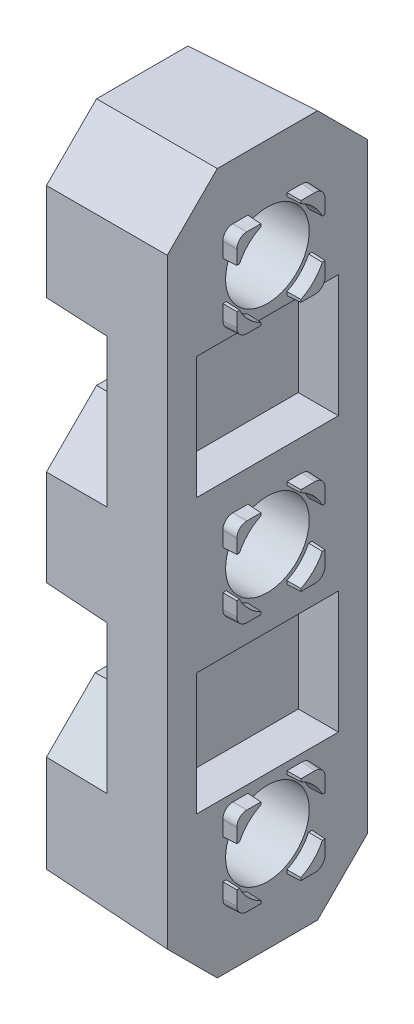
from build123d import *

# Parameters (mm, degrees)
SKETCH1_W            = 9.716506228
SKETCH1_H            = 35.116506228
BOSS_EXTRUDE1_DEPTH  = 6.35
CUT_EXTRUDE1_DEPTH   = 3.175
CUT_EXTRUDE2_DEPTH   = 3.175
CUT_EXTRUDE3_DEPTH   = 3.175
CUT_EXTRUDE4_DEPTH   = 3.175
BOSS_EXTRUDE2_DEPTH  = 0.6858
BOSS_EXTRUDE2_TAPER  = 2
BOSS_EXTRUDE3_DEPTH  = 0.6858
BOSS_EXTRUDE3_TAPER  = 2
BOSS_EXTRUDE4_DEPTH  = 0.6858
BOSS_EXTRUDE4_TAPER  = 2
BOSS_EXTRUDE5_DEPTH  = 0.6858
BOSS_EXTRUDE5_TAPER  = 2
BOSS_EXTRUDE6_DEPTH  = 0.6858
BOSS_EXTRUDE6_TAPER  = 2
BOSS_EXTRUDE7_DEPTH  = 0.6858
BOSS_EXTRUDE7_TAPER  = 2
BOSS_EXTRUDE8_DEPTH  = 0.6858
BOSS_EXTRUDE8_TAPER  = 2
BOSS_EXTRUDE9_DEPTH  = 0.6858
BOSS_EXTRUDE9_TAPER  = 2
BOSS_EXTRUDE10_DEPTH = 0.6858
BOSS_EXTRUDE10_TAPER = 2
BOSS_EXTRUDE11_DEPTH = 0.6858
BOSS_EXTRUDE11_TAPER = 2
BOSS_EXTRUDE12_DEPTH = 0.6858
BOSS_EXTRUDE12_TAPER = 2
BOSS_EXTRUDE13_DEPTH = 0.6858
BOSS_EXTRUDE13_TAPER = 2
SKETCH18_W           = 7.200000746
SKETCH18_H           = 6.200001039
CUT_EXTRUDE5_DEPTH   = 2.032
SKETCH19_W           = 7.200000746
SKETCH19_H           = 6.200000866
CUT_EXTRUDE6_DEPTH   = 2.032
DRAFT1_ANGLE         = 2.827279459
DRAFT2_ANGLE         = 2
HOLE1_D              = 4.2418
HOLE1_DEPTH          = 7.0358
CHAMFER1_SIZE        = 2.536908263
CHAMFER1_EDGE_2_SIZE = 2.536908263
CHAMFER1_EDGE_3_SIZE = 2.536908263
CHAMFER1_EDGE_4_SIZE = 2.536908263
FILLET1_R            = 0.507999989


with BuildPart() as part:
    # Sketch1 → Boss-Extrude1 (new body)
    with BuildSketch(Plane(origin=(88.976200533, 0, 0), x_dir=(0, 0, -1), z_dir=(1, 0, 0))):
        with Locations((12.699999697, 26.416015382)):
            Rectangle(SKETCH1_W, SKETCH1_H)
    extrude(amount=-BOSS_EXTRUDE1_DEPTH)

    # Sketch2 → Cut-Extrude1 (cut)
    with BuildSketch(Plane.ZY.offset(-82.626200533)):
        Polygon((-7.841746583, 36.509270747), (-10.315251163, 34.035766168), (-11.699992639, 34.035766168), (-11.699992639, 31.385266496), (-10.380199322, 31.385266496), (-7.841746583, 28.846813757), align=None)
    extrude(amount=-CUT_EXTRUDE1_DEPTH, mode=Mode.SUBTRACT)

    # Sketch3 → Cut-Extrude2 (cut)
    with BuildSketch(Plane.ZY.offset(-82.626200533)):
        Polygon((-7.841746583, 23.985217007), (-10.380199322, 21.446764268), (-11.699997599, 21.446764268), (-11.699997599, 18.796264596), (-10.315251163, 18.796264596), (-7.841746583, 16.322760016), align=None)
    extrude(amount=-CUT_EXTRUDE2_DEPTH, mode=Mode.SUBTRACT)

    # Sketch4 → Cut-Extrude3 (cut)
    with BuildSketch(Plane.ZY.offset(-82.626200533)):
        Polygon((-17.558252811, 16.322760016), (-15.084748232, 18.796264596), (-13.699997366, 18.796264596), (-13.699997366, 21.446764268), (-15.019800072, 21.446764268), (-17.558252811, 23.985217007), align=None)
    extrude(amount=-CUT_EXTRUDE3_DEPTH, mode=Mode.SUBTRACT)

    # Sketch5 → Cut-Extrude4 (cut)
    with BuildSketch(Plane.ZY.offset(-82.626200533)):
        Polygon((-17.558252811, 28.846813757), (-15.019800072, 31.385266496), (-13.699992522, 31.385266496), (-13.699992522, 34.035766168), (-15.084748232, 34.035766168), (-17.558252811, 36.509270747), align=None)
    extrude(amount=-CUT_EXTRUDE4_DEPTH, mode=Mode.SUBTRACT)

    # Sketch6 → Boss-Extrude2 (add)
    with BuildSketch(Plane(origin=(88.976200533, 0, 0), x_dir=(0, 0, -1), z_dir=(1, 0, 0))):
        with BuildLine():
            ThreePointArc((11.709394811, 24.327642329), (11.065588197, 24.781603881), (10.611626644, 25.425410496))
            Line((10.611626644, 25.425410496), (10.439394811, 25.425410496))
            Line((10.439394811, 25.425410496), (10.439394811, 24.155410496))
            Line((10.439394811, 24.155410496), (11.709394811, 24.155410496))
            Line((11.709394811, 24.155410496), (11.709394811, 24.327642329))
        make_face()
    extrude(amount=BOSS_EXTRUDE2_DEPTH, taper=BOSS_EXTRUDE2_TAPER)

    # Sketch7 → Boss-Extrude3 (add)
    with BuildSketch(Plane(origin=(88.976200533, 0, 0), x_dir=(0, 0, -1), z_dir=(1, 0, 0))):
        with BuildLine():
            ThreePointArc((14.788362978, 25.425410496), (14.334401425, 24.781603881), (13.690594811, 24.327642329))
            Line((13.690594811, 24.327642329), (13.690594811, 24.155410496))
            Line((13.690594811, 24.155410496), (14.960594811, 24.155410496))
            Line((14.960594811, 24.155410496), (14.960594811, 25.425410496))
            Line((14.960594811, 25.425410496), (14.788362978, 25.425410496))
        make_face()
    extrude(amount=BOSS_EXTRUDE3_DEPTH, taper=BOSS_EXTRUDE3_TAPER)

    # Sketch8 → Boss-Extrude4 (add)
    with BuildSketch(Plane(origin=(88.976200533, 0, 0), x_dir=(0, 0, -1), z_dir=(1, 0, 0))):
        with BuildLine():
            ThreePointArc((13.690594811, 28.504378662), (14.334401425, 28.05041711), (14.788362978, 27.406610496))
            Line((14.788362978, 27.406610496), (14.960594811, 27.406610496))
            Line((14.960594811, 27.406610496), (14.960594811, 28.676610496))
            Line((14.960594811, 28.676610496), (13.690594811, 28.676610496))
            Line((13.690594811, 28.676610496), (13.690594811, 28.504378662))
        make_face()
    extrude(amount=BOSS_EXTRUDE4_DEPTH, taper=BOSS_EXTRUDE4_TAPER)

    # Sketch9 → Boss-Extrude5 (add)
    with BuildSketch(Plane(origin=(88.976200533, 0, 0), x_dir=(0, 0, -1), z_dir=(1, 0, 0))):
        with BuildLine():
            ThreePointArc((10.611626644, 27.406610496), (11.065588197, 28.05041711), (11.709394811, 28.504378662))
            Line((11.709394811, 28.504378662), (11.709394811, 28.676610496))
            Line((11.709394811, 28.676610496), (10.439394811, 28.676610496))
            Line((10.439394811, 28.676610496), (10.439394811, 27.406610496))
            Line((10.439394811, 27.406610496), (10.611626644, 27.406610496))
        make_face()
    extrude(amount=BOSS_EXTRUDE5_DEPTH, taper=BOSS_EXTRUDE5_TAPER)

    # Sketch10 → Boss-Extrude6 (add)
    with BuildSketch(Plane(origin=(88.976200533, 0, 0), x_dir=(0, 0, -1), z_dir=(1, 0, 0))):
        with BuildLine():
            ThreePointArc((11.709394811, 37.027642329), (11.065588197, 37.481603881), (10.611626644, 38.125410496))
            Line((10.611626644, 38.125410496), (10.439394811, 38.125410496))
            Line((10.439394811, 38.125410496), (10.439394811, 36.855410496))
            Line((10.439394811, 36.855410496), (11.709394811, 36.855410496))
            Line((11.709394811, 36.855410496), (11.709394811, 37.027642329))
        make_face()
    extrude(amount=BOSS_EXTRUDE6_DEPTH, taper=BOSS_EXTRUDE6_TAPER)

    # Sketch11 → Boss-Extrude7 (add)
    with BuildSketch(Plane(origin=(88.976200533, 0, 0), x_dir=(0, 0, -1), z_dir=(1, 0, 0))):
        with BuildLine():
            ThreePointArc((14.788362978, 38.125410496), (14.334401425, 37.481603881), (13.690594811, 37.027642329))
            Line((13.690594811, 37.027642329), (13.690594811, 36.855410496))
            Line((13.690594811, 36.855410496), (14.960594811, 36.855410496))
            Line((14.960594811, 36.855410496), (14.960594811, 38.125410496))
            Line((14.960594811, 38.125410496), (14.788362978, 38.125410496))
        make_face()
    extrude(amount=BOSS_EXTRUDE7_DEPTH, taper=BOSS_EXTRUDE7_TAPER)

    # Sketch12 → Boss-Extrude8 (add)
    with BuildSketch(Plane(origin=(88.976200533, 0, 0), x_dir=(0, 0, -1), z_dir=(1, 0, 0))):
        with BuildLine():
            ThreePointArc((13.690594811, 41.204378662), (14.334401425, 40.75041711), (14.788362978, 40.106610496))
            Line((14.788362978, 40.106610496), (14.960594811, 40.106610496))
            Line((14.960594811, 40.106610496), (14.960594811, 41.376610496))
            Line((14.960594811, 41.376610496), (13.690594811, 41.376610496))
            Line((13.690594811, 41.376610496), (13.690594811, 41.204378662))
        make_face()
    extrude(amount=BOSS_EXTRUDE8_DEPTH, taper=BOSS_EXTRUDE8_TAPER)

    # Sketch13 → Boss-Extrude9 (add)
    with BuildSketch(Plane(origin=(88.976200533, 0, 0), x_dir=(0, 0, -1), z_dir=(1, 0, 0))):
        with BuildLine():
            ThreePointArc((10.611626644, 40.106610496), (11.065588197, 40.75041711), (11.709394811, 41.204378662))
            Line((11.709394811, 41.204378662), (11.709394811, 41.376610496))
            Line((11.709394811, 41.376610496), (10.439394811, 41.376610496))
            Line((10.439394811, 41.376610496), (10.439394811, 40.106610496))
            Line((10.439394811, 40.106610496), (10.611626644, 40.106610496))
        make_face()
    extrude(amount=BOSS_EXTRUDE9_DEPTH, taper=BOSS_EXTRUDE9_TAPER)

    # Sketch14 → Boss-Extrude10 (add)
    with BuildSketch(Plane(origin=(88.976200533, 0, 0), x_dir=(0, 0, -1), z_dir=(1, 0, 0))):
        with BuildLine():
            ThreePointArc((11.709394811, 11.627642329), (11.065588197, 12.081603882), (10.611626644, 12.725410496))
            Line((10.611626644, 12.725410496), (10.439394811, 12.725410496))
            Line((10.439394811, 12.725410496), (10.439394811, 11.455410496))
            Line((10.439394811, 11.455410496), (11.709394811, 11.455410496))
            Line((11.709394811, 11.455410496), (11.709394811, 11.627642329))
        make_face()
    extrude(amount=BOSS_EXTRUDE10_DEPTH, taper=BOSS_EXTRUDE10_TAPER)

    # Sketch15 → Boss-Extrude11 (add)
    with BuildSketch(Plane(origin=(88.976200533, 0, 0), x_dir=(0, 0, -1), z_dir=(1, 0, 0))):
        with BuildLine():
            ThreePointArc((14.788362978, 12.725410496), (14.334401425, 12.081603882), (13.690594811, 11.627642329))
            Line((13.690594811, 11.627642329), (13.690594811, 11.455410496))
            Line((13.690594811, 11.455410496), (14.960594811, 11.455410496))
            Line((14.960594811, 11.455410496), (14.960594811, 12.725410496))
            Line((14.960594811, 12.725410496), (14.788362978, 12.725410496))
        make_face()
    extrude(amount=BOSS_EXTRUDE11_DEPTH, taper=BOSS_EXTRUDE11_TAPER)

    # Sketch16 → Boss-Extrude12 (add)
    with BuildSketch(Plane(origin=(88.976200533, 0, 0), x_dir=(0, 0, -1), z_dir=(1, 0, 0))):
        with BuildLine():
            ThreePointArc((13.690594811, 15.804378662), (14.334401425, 15.35041711), (14.788362978, 14.706610496))
            Line((14.788362978, 14.706610496), (14.960594811, 14.706610496))
            Line((14.960594811, 14.706610496), (14.960594811, 15.976610496))
            Line((14.960594811, 15.976610496), (13.690594811, 15.976610496))
            Line((13.690594811, 15.976610496), (13.690594811, 15.804378662))
        make_face()
    extrude(amount=BOSS_EXTRUDE12_DEPTH, taper=BOSS_EXTRUDE12_TAPER)

    # Sketch17 → Boss-Extrude13 (add)
    with BuildSketch(Plane(origin=(88.976200533, 0, 0), x_dir=(0, 0, -1), z_dir=(1, 0, 0))):
        with BuildLine():
            ThreePointArc((10.611626644, 14.706610496), (11.065588197, 15.35041711), (11.709394811, 15.804378662))
            Line((11.709394811, 15.804378662), (11.709394811, 15.976610496))
            Line((11.709394811, 15.976610496), (10.439394811, 15.976610496))
            Line((10.439394811, 15.976610496), (10.439394811, 14.706610496))
            Line((10.439394811, 14.706610496), (10.611626644, 14.706610496))
        make_face()
    extrude(amount=BOSS_EXTRUDE13_DEPTH, taper=BOSS_EXTRUDE13_TAPER)

    # Sketch18 → Cut-Extrude5 (cut)
    with BuildSketch(Plane(origin=(88.976200533, 0, 0), x_dir=(0, 0, -1), z_dir=(1, 0, 0))):
        with Locations((12.699998305, 19.46600963)):
            Rectangle(SKETCH18_W, SKETCH18_H)
    extrude(amount=-CUT_EXTRUDE5_DEPTH, mode=Mode.SUBTRACT)

    # Sketch19 → Cut-Extrude6 (cut)
    with BuildSketch(Plane(origin=(88.976200533, 0, 0), x_dir=(0, 0, -1), z_dir=(1, 0, 0))):
        with Locations((12.699992957, 33.366009543)):
            Rectangle(SKETCH19_W, SKETCH19_H)
    extrude(amount=-CUT_EXTRUDE6_DEPTH, mode=Mode.SUBTRACT)

    # Draft1
    draft1_faces = [part.faces().sort_by_distance(p)[0] for p in [
        (84.213700533, 30.116040126, -9.110972953),
        (84.213700533, 22.715990637, -9.110972953),
        (84.213700533, 22.715990637, -16.289026442),
        (84.213700533, 30.116040126, -16.289026442),
    ]]
    draft(draft1_faces, Plane(origin=(82.626200533, 0, 0), x_dir=(0, 0, -1), z_dir=(-1, 0, 0)), DRAFT1_ANGLE)

    # Draft2
    draft2_faces = [part.faces().sort_by_distance(p)[0] for p in [
        (85.801200533, 43.974268496, -12.699999697),
        (84.213700533, 35.272518458, -9.078498873),
        (84.213700533, 34.035766168, -11.007621901),
        (84.254709755, 31.385266496, -10.983227185),
        (84.254709612, 21.446764268, -10.98322967),
        (84.213700533, 18.796264596, -11.007624381),
        (84.213700533, 17.559512306, -9.078498873),
        (86.238234569, 26.416015382, -7.841746583),
        (85.801200533, 8.857762268, -12.699999697),
        (84.213700533, 17.559512306, -16.321500521),
        (84.213700533, 18.796264596, -14.392372799),
        (84.254709485, 21.446764268, -14.416767505),
        (84.254709347, 31.385266496, -14.416765078),
        (84.213700533, 34.035766168, -14.392370377),
        (84.213700533, 35.272518458, -16.321500521),
        (86.238234569, 26.416015382, -17.558252811),
    ]]
    draft(draft2_faces, Plane(origin=(82.626200533, 0, 0), x_dir=(0, 0, -1), z_dir=(-1, 0, 0)), DRAFT2_ANGLE)

    # Hole1
    with Locations(Plane.ZY.offset(-82.626200533)):
        with Locations((-12.699994811, 26.416010496), (-12.699999697, 13.716015382), (-12.699999697, 39.116015382)):
            Hole(HOLE1_D / 2, depth=HOLE1_DEPTH)

    # Chamfer1
    chamfer1_edges = [part.edges().sort_by_distance(p)[0] for p in [
        (85.801200533, 44.085141939, -7.73087314),
    ]]
    chamfer(chamfer1_edges, length=CHAMFER1_SIZE)

    # Chamfer1 edge 2
    chamfer1_edge_2_edges = [part.edges().sort_by_distance(p)[0] for p in [
        (85.801200533, 44.085141939, -17.669126254),
    ]]
    chamfer(chamfer1_edge_2_edges, length=CHAMFER1_EDGE_2_SIZE)

    # Chamfer1 edge 3
    chamfer1_edge_3_edges = [part.edges().sort_by_distance(p)[0] for p in [
        (85.801200533, 8.746888825, -17.669126254),
    ]]
    chamfer(chamfer1_edge_3_edges, length=CHAMFER1_EDGE_3_SIZE)

    # Chamfer1 edge 4
    chamfer1_edge_4_edges = [part.edges().sort_by_distance(p)[0] for p in [
        (85.801200533, 8.746888825, -7.73087314),
    ]]
    chamfer(chamfer1_edge_4_edges, length=CHAMFER1_EDGE_4_SIZE)

    # Fillet1
    fillet1_edges = [part.edges().sort_by_distance(p)[0] for p in [
        (89.319100533, 24.167384827, -14.948620479),
        (89.319100533, 28.664636164, -14.948620479),
        (89.319100533, 28.664636164, -10.451369143),
        (89.319100533, 36.867384827, -10.451369143),
        (89.319100533, 36.867384827, -14.948620479),
        (89.319100533, 41.364636164, -14.948620479),
        (89.319100533, 41.364636164, -10.451369143),
        (89.319100533, 11.467384827, -10.451369143),
        (89.319100533, 11.467384827, -14.948620479),
        (89.319100533, 15.964636164, -14.948620479),
        (89.319100533, 15.964636164, -10.451369143),
        (89.319100533, 24.167384827, -10.451369143),
    ]]
    fillet(fillet1_edges, radius=FILLET1_R)


solid = part.part
